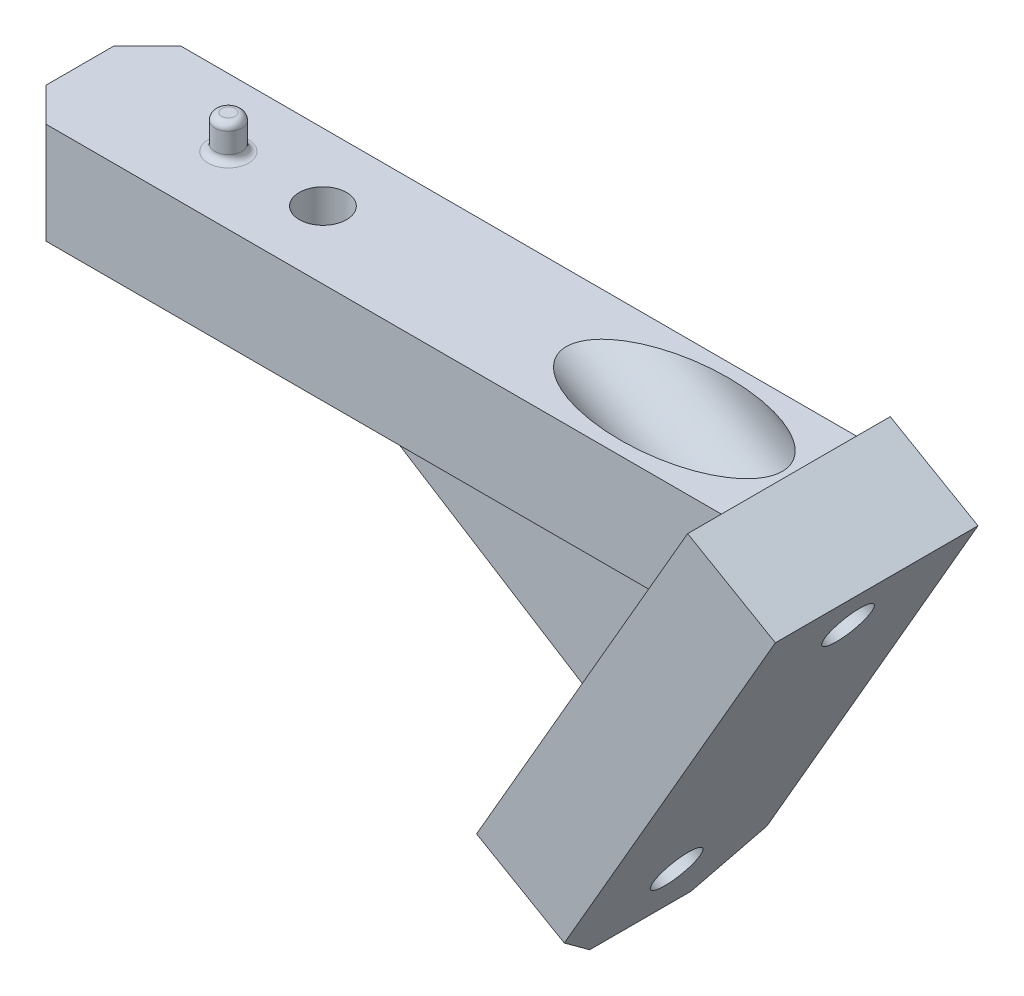
from build123d import *

# Parameters (mm, degrees)
SKETCH1_W                = 105
SKETCH1_H                = 20
BOSS_EXTRUDE1_DEPTH      = 15
SKETCH2_R                = 3.5
CUT_EXTRUDE1_DEPTH       = 15
SKETCH3_R                = 2
BOSS_EXTRUDE2_DEPTH      = 5
SKETCH4_R                = 5
CUT_EXTRUDE2_DEPTH       = 8
BOSS_EXTRUDE3_DEPTH      = 15
BOSS_EXTRUDE3_DEPTH_BACK = 15
BOSS_EXTRUDE4_DEPTH      = 5
BOSS_EXTRUDE4_DEPTH_BACK = 5
SKETCH8_R                = 3.5
CUT_EXTRUDE3_DEPTH       = 96.049456406
CHAMFER2_SIZE            = 7.5
FILLET8_R                = 1
FILLET9_R                = 1
CHAMFER4_SIZE            = 2
CHAMFER5_SIZE            = 5
CUT_EXTRUDE4_DEPTH       = 96.049456406
CUT_EXTRUDE4_DEPTH_BACK  = 96.049456406
SKETCH9_R                = 3.5
SKETCH11_R               = 8
CUT_EXTRUDE5_DEPTH       = 30


with BuildPart() as part:
    # Sketch1 → Boss-Extrude1 (new body)
    with BuildSketch(Plane(origin=(0, 0, 0), x_dir=(1, 0, 0), z_dir=(0, 1, 0))):
        Rectangle(SKETCH1_W, SKETCH1_H)
    extrude(amount=BOSS_EXTRUDE1_DEPTH)

    # Sketch2 → Cut-Extrude1 (cut)
    with BuildSketch(Plane(origin=(0, 15, 0), x_dir=(1, 0, 0), z_dir=(0, 1, 0))):
        with Locations(Location((-16.5, 0, 0), (0, 0, 270))):
            Circle(SKETCH2_R)
    extrude(amount=-CUT_EXTRUDE1_DEPTH, mode=Mode.SUBTRACT)

    # Sketch3 → Boss-Extrude2 (add)
    with BuildSketch(Plane(origin=(0, 15, 0), x_dir=(1, 0, 0), z_dir=(0, 1, 0))):
        with Locations(Location((-30.5, 0, 0), (0, 0, 270))):
            Circle(SKETCH3_R)
    extrude(amount=BOSS_EXTRUDE2_DEPTH)

    # Sketch4 → Cut-Extrude2 (cut)
    with BuildSketch(Plane.XZ):
        with Locations(Location((-16.5, 0, 0), (0, 0, 270))):
            Circle(SKETCH4_R)
    extrude(amount=-CUT_EXTRUDE2_DEPTH, mode=Mode.SUBTRACT)

    # Sketch7 → Boss-Extrude4 (add, two sides: drawn at the far end of the back side and taken through both)
    with BuildSketch(Plane.XY.offset(-BOSS_EXTRUDE4_DEPTH_BACK)):
        Polygon((-8.083911237, 0), (43.839745962, 0), (30, -23.97114317), align=None)
    extrude(amount=BOSS_EXTRUDE4_DEPTH + BOSS_EXTRUDE4_DEPTH_BACK)

    # Fillet8
    fillet8_edges = [part.edges().sort_by_distance(p)[0] for p in [
        (-30.5, 20, -2),
    ]]
    fillet(fillet8_edges, radius=FILLET8_R)

    # Fillet9
    fillet9_edges = [part.edges().sort_by_distance(p)[0] for p in [
        (-30.5, 15, -2),
    ]]
    fillet(fillet9_edges, radius=FILLET9_R)

    # Chamfer4
    chamfer4_edges = [part.edges().sort_by_distance(p)[0] for p in [
        (-16.5, 0, 5),
    ]]
    chamfer(chamfer4_edges, length=CHAMFER4_SIZE)

    # Chamfer5
    chamfer5_edges = [part.edges().sort_by_distance(p)[0] for p in [
        (-52.5, 7.5, -10),
        (-52.5, 7.5, 10),
    ]]
    chamfer(chamfer5_edges, length=CHAMFER5_SIZE)


with BuildPart() as body_2:
    # Sketch5 → Boss-Extrude3 (new, two sides: drawn at the far end of the back side and taken through both)
    with BuildSketch(Plane.XY.offset(-BOSS_EXTRUDE3_DEPTH_BACK)):
        Polygon((52.5, 15), (17.5, -45.621778265), (30.490381057, -53.121778265), (65.490381057, 7.5), align=None)
    extrude(amount=BOSS_EXTRUDE3_DEPTH + BOSS_EXTRUDE3_DEPTH_BACK)

    # Sketch8 → Cut-Extrude3 (cut, through all)
    with BuildSketch(Plane(origin=(32.879809472, -18.983166849, 0), x_dir=(0, 0, 1), z_dir=(-0.8660254037844382, 0.500000000000001, 0))):
        with Locations(Location((0, -20, 0), (0, 0, 270))):
            Circle(SKETCH8_R)
    extrude(amount=-CUT_EXTRUDE3_DEPTH, mode=Mode.SUBTRACT)

    # Chamfer2
    chamfer2_edges = [body_2.edges().sort_by_distance(p)[0] for p in [
        (23.995190528, -49.371778265, -15),
        (23.995190528, -49.371778265, 15),
    ]]
    chamfer(chamfer2_edges, length=CHAMFER2_SIZE)


with BuildPart() as cut_extrude4_tool:
    # Sketch9 → Cut-Extrude4 (new, two sides: drawn at the far end of the back side and taken through both)
    with BuildSketch(Plane(origin=(32.879809472, -18.983166849, 0), x_dir=(0, 0, 1), z_dir=(-0.8660254037844382, 0.500000000000001, 0)).offset(-CUT_EXTRUDE4_DEPTH_BACK)):
        with Locations(Location((0, 30.756735111, 0), (0, 0, 270))):
            Circle(SKETCH9_R)
    extrude(amount=CUT_EXTRUDE4_DEPTH + CUT_EXTRUDE4_DEPTH_BACK)


with BuildPart() as part_1:
    add(part.part)

    # Cut-Extrude4: cut by cut_extrude4_tool
    add(cut_extrude4_tool.part, mode=Mode.SUBTRACT)

    # Sketch11 → Cut-Extrude5 (cut)
    with BuildSketch(Plane(origin=(32.879809472, -18.983166849, 0), x_dir=(0, 0, 1), z_dir=(-0.8660254037844382, 0.500000000000001, 0))):
        with Locations(Location((0, 30.756735111, 0), (0, 0, 90))):
            Circle(SKETCH11_R)
    extrude(amount=CUT_EXTRUDE5_DEPTH, mode=Mode.SUBTRACT)


with BuildPart() as body_2_1:
    add(body_2.part)

    # Cut-Extrude4: cut by cut_extrude4_tool
    add(cut_extrude4_tool.part, mode=Mode.SUBTRACT)


solid = Compound([part_1.part, body_2_1.part])
